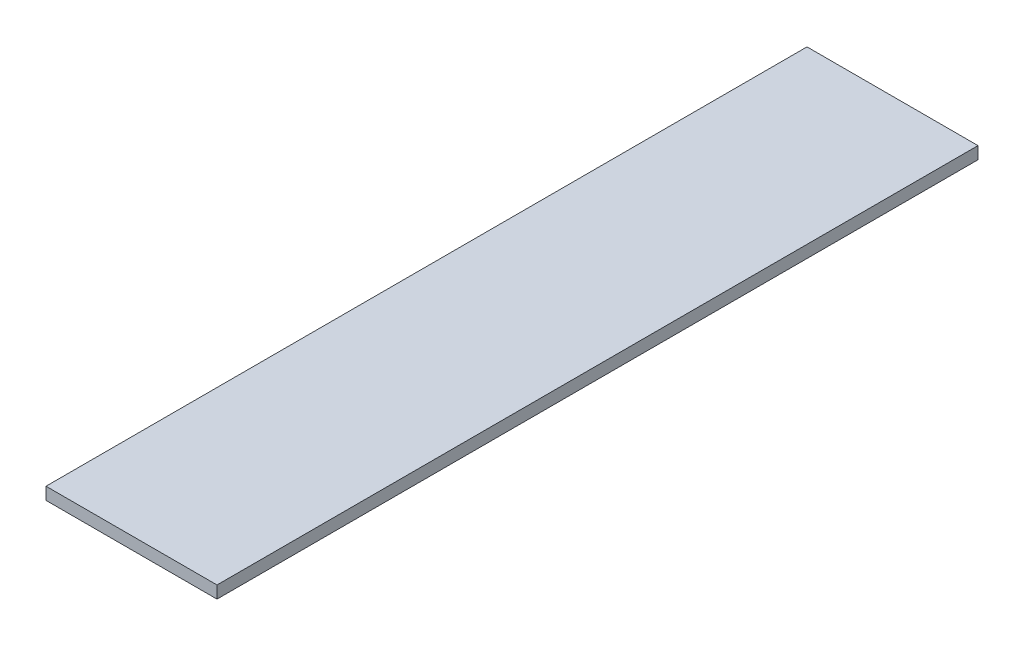
from build123d import *

# Parameters (mm, degrees)
SKETCH1_W           = 254
SKETCH1_H           = 1130.3
BOSS_EXTRUDE1_DEPTH = 18.25625


with BuildPart() as part:
    # Sketch1 → Boss-Extrude1 (new body)
    with BuildSketch(Plane(origin=(0, 0, 0), x_dir=(1, 0, 0), z_dir=(0, 1, 0))):
        with Locations((0, -565.15)):
            Rectangle(SKETCH1_W, SKETCH1_H)
    extrude(amount=BOSS_EXTRUDE1_DEPTH)


solid = part.part
